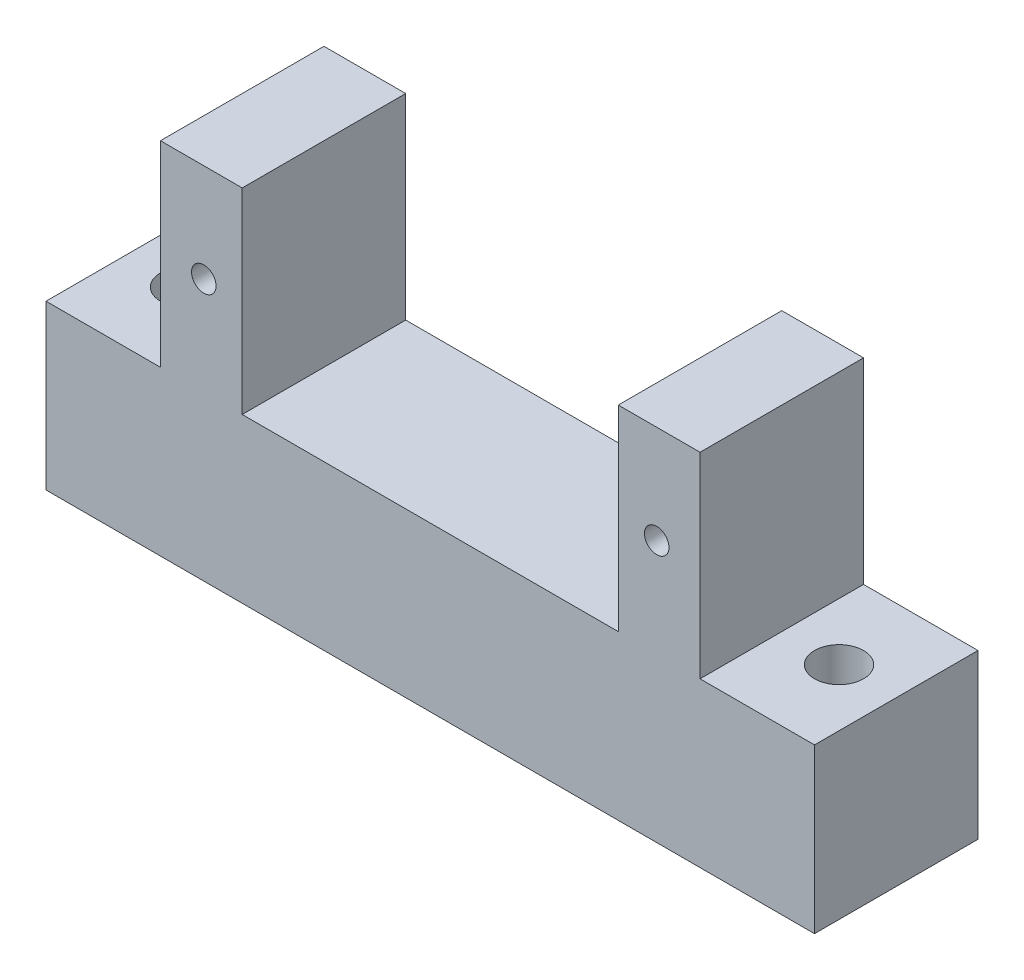
from build123d import *

# Parameters (mm, degrees)
EXTRUDE_1_DEPTH        = 3
EXTRUDE_1_DEPTH_BACK   = 7
SKETCH_1_W             = 23
SKETCH_1_H             = 10
EXTRUDE_1_2_DEPTH      = 3
EXTRUDE_1_2_DEPTH_BACK = 7
SKETCH_1_W_2           = 7
SKETCH_1_R             = 1.5
EXTRUDE_1_3_DEPTH      = 3
EXTRUDE_1_3_DEPTH_BACK = 7
EXTRUDE_2_DEPTH        = 15
EXTRUDE_2_DEPTH_BACK   = 7
SKETCH_1_4_W           = 5
SKETCH_1_4_H           = 10
SKETCH_2_R             = 0.75
CUT_EXTRUDE_1_DEPTH    = 15


with BuildPart() as part:
    # Эскиз1 → Бобышка-Вытянуть1 (new, two sides: drawn at the far end of the back side and taken through both)
    with BuildSketch(Plane(origin=(0, 0, 0), x_dir=(1, 0, 0), z_dir=(0, 1, 0)).offset(-EXTRUDE_1_DEPTH_BACK)):
        with Locations((0, -5)):
            Rectangle(SKETCH_1_W, SKETCH_1_H)
    extrude(amount=EXTRUDE_1_DEPTH + EXTRUDE_1_DEPTH_BACK)



with BuildPart() as body_2:
    # Эскиз1 → Extrude 1 2 (new, two sides: drawn at the far end of the back side and taken through both)
    with BuildSketch(Plane(origin=(0, 0, 0), x_dir=(1, 0, 0), z_dir=(0, 1, 0)).offset(-EXTRUDE_1_2_DEPTH_BACK)):
        with Locations((-20, -5)):
            Rectangle(SKETCH_1_W_2, SKETCH_1_H)
        with Locations((-20, -5)):
            Circle(SKETCH_1_R, mode=Mode.SUBTRACT)
    extrude(amount=EXTRUDE_1_2_DEPTH + EXTRUDE_1_2_DEPTH_BACK)


with BuildPart() as body_3:
    # Эскиз1 → Extrude 1 3 (new, two sides: drawn at the far end of the back side and taken through both)
    with BuildSketch(Plane(origin=(0, 0, 0), x_dir=(1, 0, 0), z_dir=(0, 1, 0)).offset(-EXTRUDE_1_3_DEPTH_BACK)):
        with Locations((20, -5)):
            Rectangle(SKETCH_1_W_2, SKETCH_1_H)
        with Locations((20, -5)):
            Circle(SKETCH_1_R, mode=Mode.SUBTRACT)
    extrude(amount=EXTRUDE_1_3_DEPTH + EXTRUDE_1_3_DEPTH_BACK)


with BuildPart() as part_1:
    add(part.part)

    add(body_2.part)  # Бобышка-Вытянуть2 merges body 2

    add(body_3.part)  # Бобышка-Вытянуть2 merges body 3
    # Эскиз1<4> → Бобышка-Вытянуть2 (add, two sides: drawn at the far end of the back side and taken through both)
    with BuildSketch(Plane(origin=(0, 0, 0), x_dir=(1, 0, 0), z_dir=(0, 1, 0)).offset(-EXTRUDE_2_DEPTH_BACK)):
        with Locations((-14, -5)):
            Rectangle(SKETCH_1_4_W, SKETCH_1_4_H)
        with Locations((14, -5)):
            Rectangle(SKETCH_1_4_W, SKETCH_1_4_H)
    extrude(amount=EXTRUDE_2_DEPTH + EXTRUDE_2_DEPTH_BACK)

    # Эскиз2 → Вырез-Вытянуть1 (cut)
    with BuildSketch(Plane(origin=(0, 0, 0), x_dir=(-1, 0, 0), z_dir=(0, 0, -1))):
        with Locations((-13.85, 9)):
            Circle(SKETCH_2_R)
        with Locations((13.85, 9)):
            Circle(SKETCH_2_R)
    extrude(amount=-CUT_EXTRUDE_1_DEPTH, mode=Mode.SUBTRACT)


solid = part_1.part
